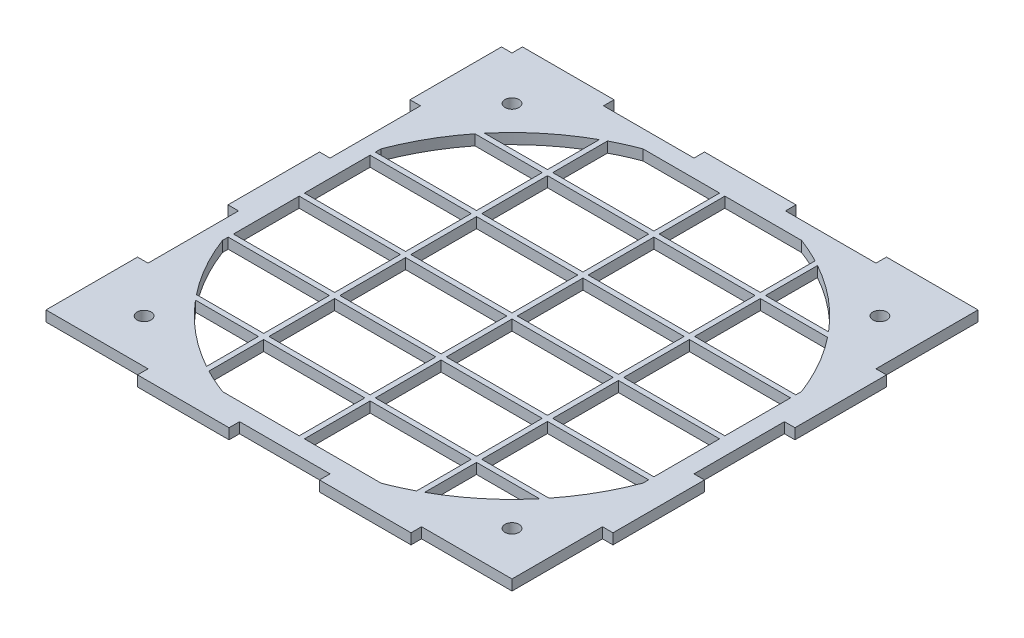
from build123d import *

# Parameters (mm, degrees)
BOSS_EXTRUDE1_DEPTH = 3
SKETCH2_W           = 130
SKETCH2_H           = 1.5
BOSS_EXTRUDE2_DEPTH = 3
SKETCH3_W           = 1.5
SKETCH3_H           = 18.75
BOSS_EXTRUDE3_DEPTH = 3
SKETCH4_R           = 2
CUT_EXTRUDE1_DEPTH  = 97.213304693


with BuildPart() as part:
    # Sketch1 → Boss-Extrude1 (new body)
    with BuildSketch(Plane(origin=(0, 0, 0), x_dir=(1, 0, 0), z_dir=(0, 1, 0))):
        Polygon((65, 38.88), (68, 38.88), (68, 12.76), (65, 12.76), (65, -13.06), (68, -13.06), (68, -39.18), (65, -39.18), (65, -65), (39.18, -65), (39.18, -68), (13.06, -68), (13.06, -65), (-12.76, -65), (-12.76, -68), (-38.88, -68), (-38.88, -65), (-64.7, -65), (-68, -65), (-68, -38.88), (-65, -38.88), (-65, -13.06), (-68, -13.06), (-68, 13.06), (-65, 13.06), (-65, 38.88), (-68, 38.88), (-68, 65), (-65, 65), (-65, 68), (-38.88, 68), (-38.88, 65), (-13.06, 65), (-13.06, 68), (13.06, 68), (13.06, 65), (38.88, 65), (38.88, 68), (65, 68), (65, 64.7), align=None)
        with BuildLine():
            Line((22.627762262, -60), (-22.627762262, -60))
            ThreePointArc((-22.627762262, -60), (-45.343222344, -45.343222344), (-60, -22.627762262))
            Line((-60, -22.627762262), (-60, 22.627762262))
            ThreePointArc((-60, 22.627762262), (-45.343222344, 45.343222344), (-22.627762262, 60))
            Line((-22.627762262, 60), (22.627762262, 60))
            ThreePointArc((22.627762262, 60), (45.343222344, 45.343222344), (60, 22.627762262))
            Line((60, 22.627762262), (60, -22.627762262))
            ThreePointArc((60, -22.627762262), (45.343222344, -45.343222344), (22.627762262, -60))
        make_face(mode=Mode.SUBTRACT)
    extrude(amount=BOSS_EXTRUDE1_DEPTH)

    # Sketch2 → Boss-Extrude2 (add, through all)
    with BuildSketch(Plane(origin=(0, 3, 0), x_dir=(1, 0, 0), z_dir=(0, 1, 0))):
        with Locations((0, 60.75)):
            Rectangle(SKETCH2_W, SKETCH2_H)
        with Locations((0, 40.5)):
            Rectangle(SKETCH2_W, SKETCH2_H)
        with Locations((0, 20.25)):
            Rectangle(SKETCH2_W, SKETCH2_H)
        Rectangle(SKETCH2_W, SKETCH2_H)
        with Locations((0, -20.25)):
            Rectangle(SKETCH2_W, SKETCH2_H)
        with Locations((0, -40.5)):
            Rectangle(SKETCH2_W, SKETCH2_H)
        with Locations((0, -60.75)):
            Rectangle(SKETCH2_W, SKETCH2_H)
    extrude(amount=-BOSS_EXTRUDE2_DEPTH)

    # Sketch3 → Boss-Extrude3 (add, through all)
    with BuildSketch(Plane(origin=(0, 3, 0), x_dir=(1, 0, 0), z_dir=(0, 1, 0))):
        with Locations((-30.375, -30.375)):
            Rectangle(SKETCH3_W, SKETCH3_H)
        with Locations((-30.375, -10.125)):
            Rectangle(SKETCH3_W, SKETCH3_H)
        with BuildLine():
            Line((-29.625, -41.25), (-31.125, -41.25))
            Line((-31.125, -41.25), (-31.125, -56.064694773))
            ThreePointArc((-31.125, -56.064694773), (-30.377679063, -56.473110768), (-29.625, -56.87156583))
            Line((-29.625, -56.87156583), (-29.625, -41.25))
        make_face()
        with Locations((0, -30.375)):
            Rectangle(SKETCH3_W, SKETCH3_H)
        with Locations((-30.375, 30.375)):
            Rectangle(SKETCH3_W, SKETCH3_H)
        with Locations((-30.375, 10.125)):
            Rectangle(SKETCH3_W, SKETCH3_H)
        with Locations((0, -10.125)):
            Rectangle(SKETCH3_W, SKETCH3_H)
        with Locations((0, -50.625)):
            Rectangle(SKETCH3_W, SKETCH3_H)
        with BuildLine():
            Line((-31.125, 56.064694773), (-31.125, 41.25))
            Line((-31.125, 41.25), (-29.625, 41.25))
            Line((-29.625, 41.25), (-29.625, 56.87156583))
            ThreePointArc((-29.625, 56.87156583), (-30.377679063, 56.473110768), (-31.125, 56.064694773))
        make_face()
        with Locations((30.375, -30.375)):
            Rectangle(SKETCH3_W, SKETCH3_H)
        with Locations((0, 30.375)):
            Rectangle(SKETCH3_W, SKETCH3_H)
        with Locations((0, 10.125)):
            Rectangle(SKETCH3_W, SKETCH3_H)
        with Locations((30.375, -10.125)):
            Rectangle(SKETCH3_W, SKETCH3_H)
        with BuildLine():
            Line((31.125, -41.25), (29.625, -41.25))
            Line((29.625, -41.25), (29.625, -56.87156583))
            ThreePointArc((29.625, -56.87156583), (30.377679063, -56.473110768), (31.125, -56.064694773))
            Line((31.125, -56.064694773), (31.125, -41.25))
        make_face()
        with Locations((0, 50.625)):
            Rectangle(SKETCH3_W, SKETCH3_H)
        with Locations((30.375, 30.375)):
            Rectangle(SKETCH3_W, SKETCH3_H)
        with Locations((30.375, 10.125)):
            Rectangle(SKETCH3_W, SKETCH3_H)
        with BuildLine():
            Line((29.625, 56.87156583), (29.625, 41.25))
            Line((29.625, 41.25), (31.125, 41.25))
            Line((31.125, 41.25), (31.125, 56.064694773))
            ThreePointArc((31.125, 56.064694773), (30.377679063, 56.473110768), (29.625, 56.87156583))
        make_face()
    extrude(amount=-BOSS_EXTRUDE3_DEPTH)

    # Sketch4 → Cut-Extrude1 (cut, through all)
    with BuildSketch(Plane(origin=(0, 3, 0), x_dir=(1, 0, 0), z_dir=(0, 1, 0))):
        with Locations(Location((-52.5, 52.5, 0), (0, 0, 270))):
            Circle(SKETCH4_R)
        with Locations(Location((52.5, 52.5, 0), (0, 0, 270))):
            Circle(SKETCH4_R)
        with Locations(Location((52.5, -52.5, 0), (0, 0, 270))):
            Circle(SKETCH4_R)
        with Locations(Location((-52.5, -52.5, 0), (0, 0, 270))):
            Circle(SKETCH4_R)
    extrude(amount=-CUT_EXTRUDE1_DEPTH, mode=Mode.SUBTRACT)


solid = part.part
